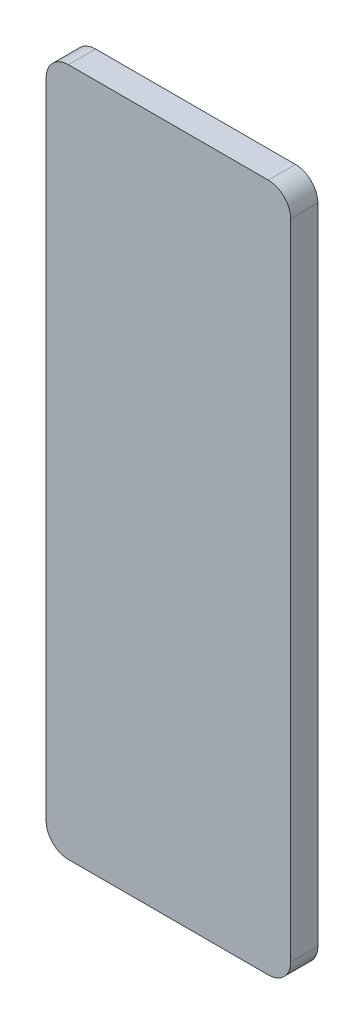
from build123d import *

# Parameters (mm, degrees)
SKETCH_1_W      = 1.35
SKETCH_1_H      = 3.8
EXTRUDE_1_DEPTH = 0.15
FILLET_1_R      = 0.123333333


with BuildPart() as part:
    # 草图1 → 凸台-拉伸1 (new body)
    with BuildSketch(Plane.XY):
        Rectangle(SKETCH_1_W, SKETCH_1_H)
    extrude(amount=EXTRUDE_1_DEPTH)

    # 圆角1
    fillet_1_edges = [part.edges().sort_by_distance(p)[0] for p in [
        (0.675, -1.9, 0.075),
        (-0.675, -1.9, 0.075),
        (-0.675, 1.9, 0.075),
        (0.675, 1.9, 0.075),
    ]]
    fillet(fillet_1_edges, radius=FILLET_1_R)


solid = part.part
